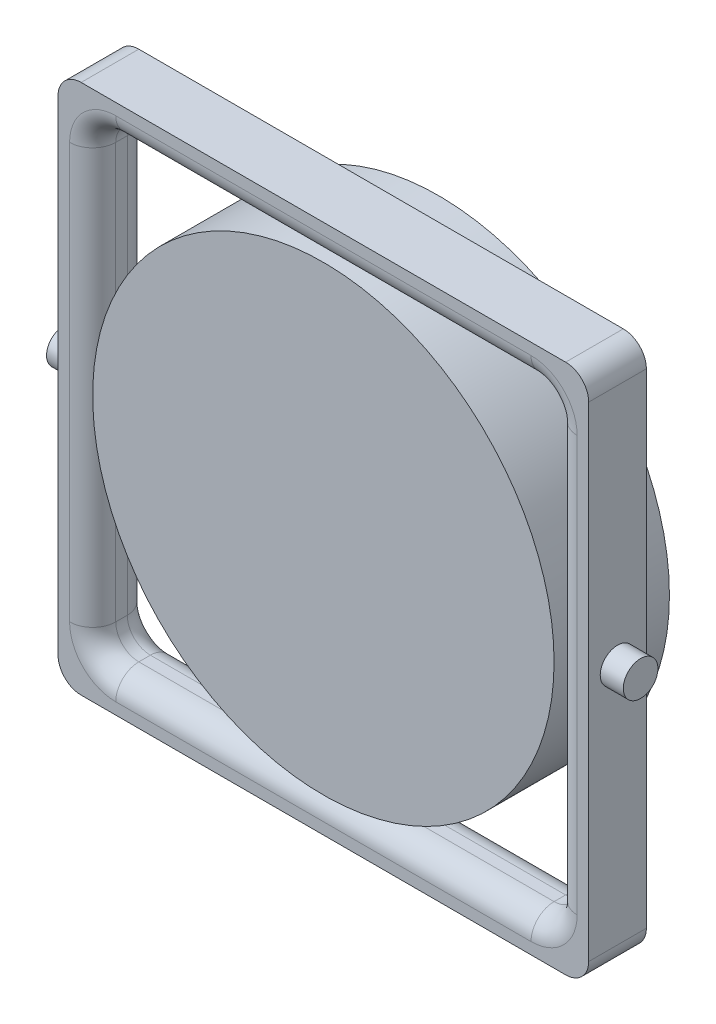
from build123d import *

# Parameters (mm, degrees)
SKETCH1_W           = 46
SKETCH1_H           = 46
BOSS_EXTRUDE2_DEPTH = 5
SKETCH3_W           = 40
SKETCH3_H           = 40
CUT_EXTRUDE1_DEPTH  = 15
FILLET1_R           = 2
FILLET2_R           = 2
FILLET3_R           = 2
BOSS_EXTRUDE3_DEPTH = 2
SKETCH5_R           = 20
BOSS_EXTRUDE4_DEPTH = 10


with BuildPart() as part:
    # Sketch1 → Boss-Extrude2 (new body)
    with BuildSketch(Plane.XY):
        Rectangle(SKETCH1_W, SKETCH1_H)
    extrude(amount=BOSS_EXTRUDE2_DEPTH)

    # Sketch3 → Cut-Extrude1 (cut)
    with BuildSketch(Plane.XY.offset(5)):
        Rectangle(SKETCH3_W, SKETCH3_H)
    extrude(amount=-CUT_EXTRUDE1_DEPTH, mode=Mode.SUBTRACT)

    # Fillet1
    fillet1_edges = [part.edges().sort_by_distance(p)[0] for p in [
        (20, 20, 2.5),
        (20, -20, 2.5),
        (-20, -20, 2.5),
        (-20, 20, 2.5),
    ]]
    fillet(fillet1_edges, radius=FILLET1_R)

    # Fillet2
    fillet2_edges = [part.edges().sort_by_distance(p)[0] for p in [
        (20, 0, 0),
        (0, -20, 0),
        (-20, 0, 0),
        (0, 20, 0),
        (19.414213562, -19.414213562, 0),
        (-19.414213562, -19.414213562, 0),
        (-19.414213562, 19.414213562, 0),
        (19.414213562, 19.414213562, 0),
        (23, -23, 2.5),
        (-23, -23, 2.5),
        (-23, 23, 2.5),
        (23, 23, 2.5),
    ]]
    fillet(fillet2_edges, radius=FILLET2_R)

    # Fillet3
    fillet3_edges = [part.edges().sort_by_distance(p)[0] for p in [
        (20, 0, 5),
        (0, -20, 5),
        (-20, 0, 5),
        (0, 20, 5),
        (19.414213562, -19.414213562, 5),
        (-19.414213562, -19.414213562, 5),
        (-19.414213562, 19.414213562, 5),
        (19.414213562, 19.414213562, 5),
    ]]
    fillet(fillet3_edges, radius=FILLET3_R)

    # Sketch4 → Boss-Extrude3 (add)
    with BuildSketch(Plane(origin=(23, 0, 0), x_dir=(0, 0, -1), z_dir=(1, 0, 0))):
        with BuildLine():
            ThreePointArc((-4, 0), (-2.5, -1.5), (-1, 0))
            Line((-1, 0), (-4, 0))
        make_face()
        with BuildLine():
            Line((-4, 0), (-1, 0))
            ThreePointArc((-1, 0), (-2.5, 1.5), (-4, 0))
        make_face()
    boss_extrude3 = extrude(amount=BOSS_EXTRUDE3_DEPTH)

    # Mirror1: Boss-Extrude3 across plane
    add(boss_extrude3.mirror(Plane(origin=(0, 0, 0), x_dir=(0, 0, 1), z_dir=(1, 0, 0))))


with BuildPart() as body_2:
    # Sketch5 → Boss-Extrude4 (new body)
    with BuildSketch(Plane.XY.offset(5)):
        Circle(SKETCH5_R)
    extrude(amount=-BOSS_EXTRUDE4_DEPTH)


solid = Compound([part.part, body_2.part])
